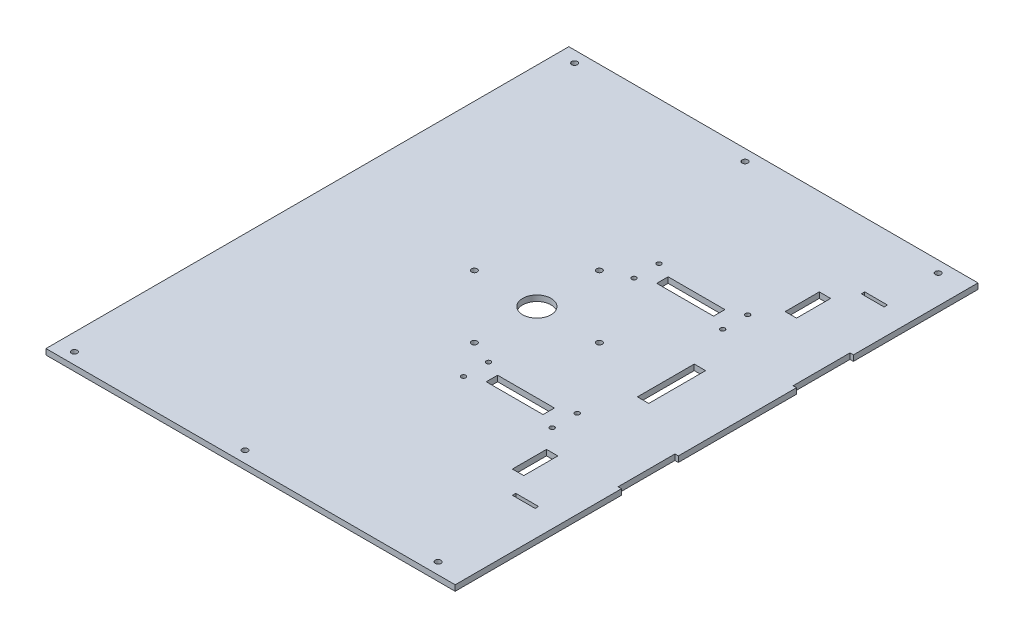
from build123d import *

# Parameters (mm, degrees)
EXTRUDE_1_DEPTH     = 5
SKETCH_2_W          = 20
SKETCH_2_H          = 3
SKETCH_2_W_2        = 10
SKETCH_2_H_2        = 30
SKETCH_2_H_3        = 50
CUT_EXTRUDE_1_DEPTH = 211.35683968
EXTRUDE_2_DEPTH     = 5
SKETCH_4_R          = 2
CUT_EXTRUDE_2_DEPTH = 620.212910153
SKETCH_6_W          = 3
SKETCH_6_H          = 50
SKETCH_6_H_2        = 104
EXTRUDE_3_DEPTH     = 5
EXTRUDE_4_DEPTH     = 5
SKETCH_8_R          = 2
SKETCH_8_W          = 50
SKETCH_8_H          = 10
CUT_EXTRUDE_3_DEPTH = 620.212910153
SKETCH_9_R          = 2
CUT_EXTRUDE_4_DEPTH = 620.212910153
SKETCH_10_R         = 7.5
CUT_EXTRUDE_5_DEPTH = 620.212910153
EXTRUDE_5_DEPTH     = 5
SKETCH_12_W         = 370.436309817
SKETCH_12_H         = 460
CUT_EXTRUDE_6_DEPTH = 641.99462376
SKETCH_15_R         = 2.5
SKETCH_15_R_2       = 12.5
CUT_EXTRUDE_7_DEPTH = 358.41919309
SKETCH_16_R         = 2
EXTRUDE_6_DEPTH     = 5


with BuildPart() as part:
    # 스케치1 → 보스-돌출1 (new body)
    with BuildSketch(Plane(origin=(0, 0, 0), x_dir=(1, 0, 0), z_dir=(0, 1, 0))):
        Polygon((-50, 175), (0, 175), (0, 185), (50, 185), (50, 175), (100, 175), (100, -175), (50, -175), (50, -185), (0, -185), (0, -175), (-50, -175), (-50, -185), (-100, -185), (-100, -175), (-100, 175), (-100, 185), (-50, 185), align=None)
    extrude(amount=EXTRUDE_1_DEPTH)

    # 스케치2 → 컷-돌출1 (cut, through all)
    with BuildSketch(Plane(origin=(0, 5, 0), x_dir=(1, 0, 0), z_dir=(0, 1, 0))):
        with Locations((70, 153.5)):
            Rectangle(SKETCH_2_W, SKETCH_2_H)
        with Locations((70, -153.5)):
            Rectangle(SKETCH_2_W, SKETCH_2_H)
        with Locations((45, 120)):
            Rectangle(SKETCH_2_W_2, SKETCH_2_H_2)
        with Locations((45, -120)):
            Rectangle(SKETCH_2_W_2, SKETCH_2_H_2)
        with Locations((45, 0)):
            Rectangle(SKETCH_2_W_2, SKETCH_2_H_3)
    extrude(amount=-CUT_EXTRUDE_1_DEPTH, mode=Mode.SUBTRACT)

    # 스케치3 → 보스-돌출2 (add)
    with BuildSketch(Plane(origin=(0, 5, 0), x_dir=(1, 0, 0), z_dir=(0, 1, 0))):
        Polygon((-540.91, 50), (-225, 50), (-100, 50), (-100, -50), (-225, -50), (-540.91, -50), (-540.91, -185), (-590.91, -185), (-590.91, 185), (-540.91, 185), align=None)
    extrude(amount=-EXTRUDE_2_DEPTH)

    # 스케치4 → 컷-돌출2 (cut, through all)
    with BuildSketch(Plane(origin=(0, 5, 0), x_dir=(1, 0, 0), z_dir=(0, 1, 0))):
        with Locations(Location((-578.91, 145, 0), (0, 0, 270))):
            Circle(SKETCH_4_R)
        with Locations(Location((-578.91, 95, 0), (0, 0, 270))):
            Circle(SKETCH_4_R)
        with Locations(Location((-566.91, 145, 0), (0, 0, 270))):
            Circle(SKETCH_4_R)
        with Locations(Location((-566.91, 95, 0), (0, 0, 270))):
            Circle(SKETCH_4_R)
        with Locations(Location((-578.91, -145, 0), (0, 0, 270))):
            Circle(SKETCH_4_R)
        with Locations(Location((-578.91, -95, 0), (0, 0, 270))):
            Circle(SKETCH_4_R)
        with Locations(Location((-566.91, -95, 0), (0, 0, 270))):
            Circle(SKETCH_4_R)
        with Locations(Location((-566.91, -145, 0), (0, 0, 270))):
            Circle(SKETCH_4_R)
    extrude(amount=-CUT_EXTRUDE_2_DEPTH, mode=Mode.SUBTRACT)

    # 스케치6 → 보스-돌출3 (add)
    with BuildSketch(Plane(origin=(0, 5, 0), x_dir=(1, 0, 0), z_dir=(0, 1, 0))):
        with Locations((101.5, -127)):
            Rectangle(SKETCH_6_W, SKETCH_6_H)
        with Locations((101.5, 127)):
            Rectangle(SKETCH_6_W, SKETCH_6_H)
        with Locations((101.5, 0)):
            Rectangle(SKETCH_6_W, SKETCH_6_H_2)
    extrude(amount=-EXTRUDE_3_DEPTH)

    # 스케치7 → 보스-돌출4 (add)
    with BuildSketch(Plane(origin=(0, 5, 0), x_dir=(1, 0, 0), z_dir=(0, 1, 0))):
        Polygon((-540.91, -185), (-537.91, -185), (-537.91, -92), (-495.91, -50), (-540.91, -50), align=None)
        Polygon((-537.91, 92), (-495.91, 50), (-540.91, 50), (-540.91, 185), (-537.91, 185), align=None)
        Polygon((-100, 95), (-145, 50), (-100, 50), align=None)
        Polygon((-100, -95), (-145, -50), (-100, -50), align=None)
    extrude(amount=-EXTRUDE_4_DEPTH)

    # 스케치8 → 컷-돌출3 (cut, through all)
    with BuildSketch(Plane(origin=(0, 5, 0), x_dir=(1, 0, 0), z_dir=(0, 1, 0))):
        with Locations(Location((-52, 86, 0), (0, 0, 270))):
            Circle(SKETCH_8_R)
        with Locations(Location((-52, 64, 0), (0, 0, 270))):
            Circle(SKETCH_8_R)
        with Locations(Location((26, 86, 0), (0, 0, 270))):
            Circle(SKETCH_8_R)
        with Locations(Location((26, 64, 0), (0, 0, 270))):
            Circle(SKETCH_8_R)
        with Locations(Location((-52, -86, 0), (0, 0, 90))):
            Circle(SKETCH_8_R)
        with Locations(Location((-52, -64, 0), (0, 0, 90))):
            Circle(SKETCH_8_R)
        with Locations(Location((26, -64, 0), (0, 0, 90))):
            Circle(SKETCH_8_R)
        with Locations(Location((26, -86, 0), (0, 0, 90))):
            Circle(SKETCH_8_R)
        with Locations((-13, 75)):
            Rectangle(SKETCH_8_W, SKETCH_8_H)
        with Locations((-13, -75)):
            Rectangle(SKETCH_8_W, SKETCH_8_H)
    extrude(amount=-CUT_EXTRUDE_3_DEPTH, mode=Mode.SUBTRACT)

    # 스케치9 → 컷-돌출4 (cut, through all)
    with BuildSketch(Plane(origin=(0, 5, 0), x_dir=(1, 0, 0), z_dir=(0, 1, 0))):
        with Locations(Location((-437.91, 30, 0), (0, 0, 270))):
            Circle(SKETCH_9_R)
        with Locations(Location((-235.58, 30, 0), (0, 0, 270))):
            Circle(SKETCH_9_R)
        with Locations(Location((-185.58, 30, 0), (0, 0, 270))):
            Circle(SKETCH_9_R)
        with Locations(Location((-185.58, -30, 0), (0, 0, 90))):
            Circle(SKETCH_9_R)
        with Locations(Location((-235.58, -30, 0), (0, 0, 90))):
            Circle(SKETCH_9_R)
        with Locations(Location((-437.91, -30, 0), (0, 0, 90))):
            Circle(SKETCH_9_R)
    extrude(amount=-CUT_EXTRUDE_4_DEPTH, mode=Mode.SUBTRACT)

    # 스케치10 → 컷-돌출5 (cut, through all)
    with BuildSketch(Plane(origin=(0, 5, 0), x_dir=(1, 0, 0), z_dir=(0, 1, 0))):
        with Locations(Location((-73, 0, 0), (0, 0, 270))):
            Circle(SKETCH_10_R)
    extrude(amount=-CUT_EXTRUDE_5_DEPTH, mode=Mode.SUBTRACT)

    # 스케치11 → 보스-돌출5 (add)
    with BuildSketch(Plane(origin=(0, 5, 0), x_dir=(1, 0, 0), z_dir=(0, 1, 0))):
        Polygon((-145, -50), (-257, -50), (-257, -248.343471002), (103, -248.343471002), (103, -152), (100, -152), (100, -175), (50, -175), (50, -185), (0, -185), (0, -175), (-50, -175), (-50, -185), (-100, -185), (-100, -95), align=None)
        Polygon((103, 152), (103, 211.656528998), (-257, 211.656528998), (-257, 50), (-145, 50), (-100, 95), (-100, 185), (-50, 185), (-50, 175), (0, 175), (0, 185), (50, 185), (50, 175), (100, 175), (100, 152), align=None)
    extrude(amount=-EXTRUDE_5_DEPTH)

    # 스케치12 → 컷-돌출6 (cut, through all)
    with BuildSketch(Plane(origin=(0, 5, 0), x_dir=(1, 0, 0), z_dir=(0, 1, 0))):
        with Locations((-442.218154909, -18.343471002)):
            Rectangle(SKETCH_12_W, SKETCH_12_H)
    extrude(amount=-CUT_EXTRUDE_6_DEPTH, mode=Mode.SUBTRACT)

    # 스케치15 → 컷-돌출7 (cut, through all)
    with BuildSketch(Plane(origin=(0, 5, 0), x_dir=(1, 0, 0), z_dir=(0, 1, 0))):
        with Locations(Location((-73.050208533, -55.416458765, 0), (0, 0, 270))):
            Circle(SKETCH_15_R)
        with Locations(Location((-128.050208533, -0.416458765, 0), (0, 0, 270))):
            Circle(SKETCH_15_R)
        with Locations(Location((-73.050208533, 54.583541235, 0), (0, 0, 270))):
            Circle(SKETCH_15_R)
        with Locations(Location((-18.050208533, -0.416458765, 0), (0, 0, 270))):
            Circle(SKETCH_15_R)
        with Locations(Location((-73.050208533, -0.416458765, 0), (0, 0, 270))):
            Circle(SKETCH_15_R_2)
        with Locations(Location((-242, 201.656528998, 0), (0, 0, 270))):
            Circle(SKETCH_15_R)
        with Locations(Location((-92, 201.656528998, 0), (0, 0, 270))):
            Circle(SKETCH_15_R)
        with Locations(Location((78, 201.656528998, 0), (0, 0, 270))):
            Circle(SKETCH_15_R)
        with Locations(Location((78, -238.343471002, 0), (0, 0, 90))):
            Circle(SKETCH_15_R)
        with Locations(Location((-92, -238.343471002, 0), (0, 0, 90))):
            Circle(SKETCH_15_R)
        with Locations(Location((-242, -238.343471002, 0), (0, 0, 90))):
            Circle(SKETCH_15_R)
    extrude(amount=-CUT_EXTRUDE_7_DEPTH, mode=Mode.SUBTRACT)

    # 스케치16 → 보스-돌출6 (add)
    with BuildSketch(Plane(origin=(0, 5, 0), x_dir=(1, 0, 0), z_dir=(0, 1, 0))):
        with Locations((-185.58, -30)):
            Circle(SKETCH_16_R)
        with Locations((-235.58, -30)):
            Circle(SKETCH_16_R)
        with Locations((-185.58, 30)):
            Circle(SKETCH_16_R)
        with Locations((-235.58, 30)):
            Circle(SKETCH_16_R)
    extrude(amount=-EXTRUDE_6_DEPTH)


solid = part.part
